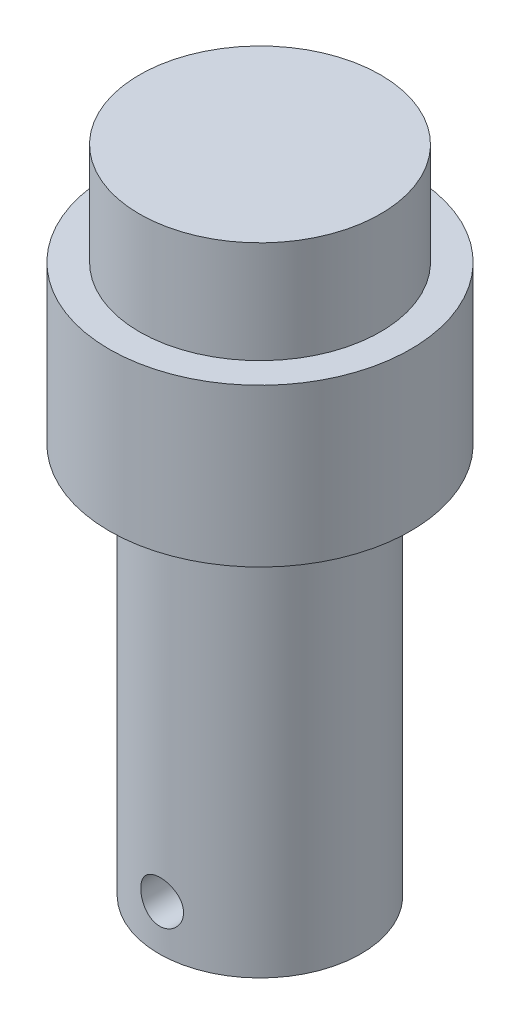
from build123d import *

# Parameters (mm, degrees)
SKETCH1_R               = 7.5565
BOSS_EXTRUDE1_DEPTH     = 29.2608
SKETCH2_R               = 11.2776
BOSS_EXTRUDE2_DEPTH     = 11.78052
SKETCH3_R               = 9.02208
BOSS_EXTRUDE3_DEPTH     = 7.63524
CUT_EXTRUDE1_DEPTH      = 52.222807586
CUT_EXTRUDE1_DEPTH_BACK = 52.222807586
SKETCH4_R               = 1.5875


with BuildPart() as part:
    # Sketch1 → Boss-Extrude1 (new body)
    with BuildSketch(Plane(origin=(0, 0, 0), x_dir=(1, 0, 0), z_dir=(0, 1, 0))):
        with Locations(Location((0, 0, 0), (0, 0, 270))):
            Circle(SKETCH1_R)
    extrude(amount=BOSS_EXTRUDE1_DEPTH)

    # Sketch2 → Boss-Extrude2 (add)
    with BuildSketch(Plane(origin=(0, 29.2608, 0), x_dir=(1, 0, 0), z_dir=(0, 1, 0))):
        with Locations(Location((0, 0, 0), (0, 0, 90))):
            Circle(SKETCH2_R)
    extrude(amount=BOSS_EXTRUDE2_DEPTH)

    # Sketch3 → Boss-Extrude3 (add)
    with BuildSketch(Plane(origin=(0, 41.04132, 0), x_dir=(1, 0, 0), z_dir=(0, 1, 0))):
        with Locations(Location((0, 0, 0), (0, 0, 90))):
            Circle(SKETCH3_R)
    extrude(amount=BOSS_EXTRUDE3_DEPTH)

    # Sketch4 → Cut-Extrude1 (cut, two sides: drawn at the far end of the back side and taken through both)
    with BuildSketch(Plane.XY.offset(-CUT_EXTRUDE1_DEPTH_BACK)):
        with Locations((0.06604, 3.402959253)):
            Circle(SKETCH4_R)
    extrude(amount=CUT_EXTRUDE1_DEPTH + CUT_EXTRUDE1_DEPTH_BACK, mode=Mode.SUBTRACT)


solid = part.part
